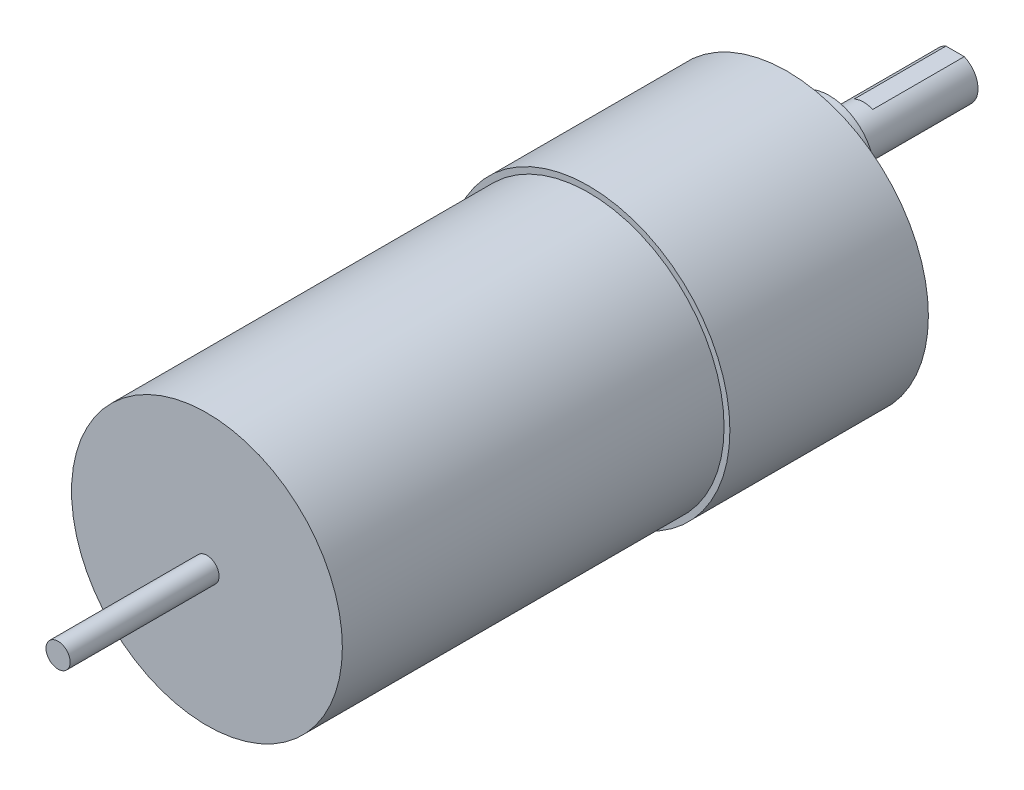
from build123d import *

# Parameters (mm, degrees)
SKETCH2_R               = 18.5
BOSS_EXTRUDE1_DEPTH     = 26
SKETCH3_R               = 17.738120084
BOSS_EXTRUDE2_DEPTH     = 50
SKETCH4_R               = 1.585
BOSS_EXTRUDE3_DEPTH     = 19.5
SKETCH5_R               = 6
BOSS_EXTRUDE4_DEPTH     = 5.5
SKETCH6_R               = 3
BOSS_EXTRUDE5_DEPTH     = 16.5
CUT_EXTRUDE1_DEPTH      = 121.377531126
CUT_EXTRUDE1_DEPTH_BACK = 12


with BuildPart() as part:
    # Sketch2 → Boss-Extrude1 (new body)
    with BuildSketch(Plane.XY):
        with Locations(Location((0, 0, 0), (0, 0, 180))):
            Circle(SKETCH2_R)
    extrude(amount=BOSS_EXTRUDE1_DEPTH)

    # Sketch3 → Boss-Extrude2 (add)
    with BuildSketch(Plane.XY.offset(26)):
        Circle(SKETCH3_R)
    extrude(amount=BOSS_EXTRUDE2_DEPTH)

    # Sketch4 → Boss-Extrude3 (add)
    with BuildSketch(Plane.XY.offset(76)):
        Circle(SKETCH4_R)
    extrude(amount=BOSS_EXTRUDE3_DEPTH)

    # Sketch5 → Boss-Extrude4 (add)
    with BuildSketch(Plane(origin=(0, 0, 0), x_dir=(-1, 0, 0), z_dir=(0, 0, -1))):
        with Locations(Location((0, 7, 0), (0, 0, 180))):
            Circle(SKETCH5_R)
    extrude(amount=BOSS_EXTRUDE4_DEPTH)

    # Sketch6 → Boss-Extrude5 (add)
    with BuildSketch(Plane(origin=(0, 0, -5.5), x_dir=(-1, 0, 0), z_dir=(0, 0, -1))):
        with Locations((0, 7)):
            Circle(SKETCH6_R)
    extrude(amount=BOSS_EXTRUDE5_DEPTH)

    # Sketch7 → Cut-Extrude1 (cut, two sides: drawn at the far end of the back side and taken through both)
    with BuildSketch(Plane(origin=(0, 0, -22), x_dir=(-1, 0, 0), z_dir=(0, 0, -1)).offset(-CUT_EXTRUDE1_DEPTH_BACK)):
        with BuildLine():
            ThreePointArc((1.198957881, 9.75), (0, 10), (-1.198957881, 9.75))
            Line((-1.198957881, 9.75), (1.198957881, 9.75))
        make_face()
    extrude(amount=CUT_EXTRUDE1_DEPTH + CUT_EXTRUDE1_DEPTH_BACK, mode=Mode.SUBTRACT)


solid = part.part
